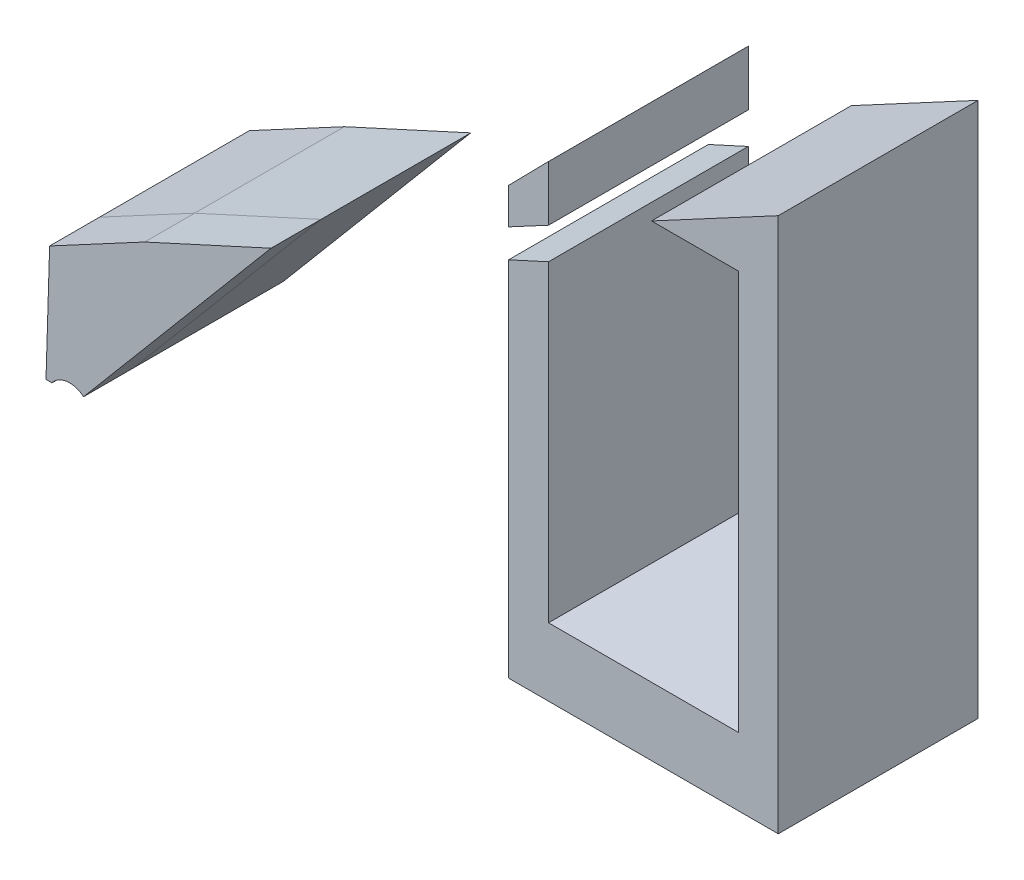
from build123d import *

# Parameters (mm, degrees)
BOSS_EXTRUDE2_DEPTH   = 15
BOSS_EXTRUDE2_2_DEPTH = 15
SKETCH1_3_W           = 4
SKETCH1_3_H           = 40
BOSS_EXTRUDE3_DEPTH   = 20
BOSS_EXTRUDE3_2_DEPTH = 20
BOSS_EXTRUDE4_DEPTH   = 20
BOSS_EXTRUDE5_DEPTH   = 5


with BuildPart() as part:
    # Sketch1 → Boss-Extrude2 (new body)
    with BuildSketch(Plane.XY):
        with BuildLine():
            Line((-90.5, 174.7), (-90.5, 180))
            Line((-90.5, 180), (-109.5, 180))
            Line((-109.5, 180), (-109.5, 174.7))
            ThreePointArc((-109.5, 174.7), (-109.060660172, 173.639339828), (-108, 173.2))
            Line((-108, 173.2), (-106.25, 173.2))
            Line((-106.25, 173.2), (-106.25, 173.789613301))
            ThreePointArc((-106.25, 173.789613301), (-105, 177.8), (-103.75, 173.789613301))
            Line((-103.75, 173.789613301), (-103.75, 173.2))
            Line((-103.75, 173.2), (-96.25, 173.2))
            Line((-96.25, 173.2), (-96.25, 173.789613301))
            ThreePointArc((-96.25, 173.789613301), (-95, 177.8), (-93.75, 173.789613301))
            Line((-93.75, 173.789613301), (-93.75, 173.2))
            Line((-93.75, 173.2), (-92, 173.2))
            ThreePointArc((-92, 173.2), (-90.939339828, 173.639339828), (-90.5, 174.7))
        make_face()
    extrude(amount=BOSS_EXTRUDE2_DEPTH)



with BuildPart() as body_2:
    # Sketch1 → Boss-Extrude2 2 (new body)
    with BuildSketch(Plane.XY):
        with BuildLine():
            Line((-156.05225023, 176.325380111), (-137.282205372, 198.590028265))
            Line((-137.282205372, 198.590028265), (-149.934908507, 192.799492861))
            Line((-149.934908507, 192.799492861), (-159.451892195, 187.698480193))
            Line((-159.451892195, 187.698480193), (-159.505987475, 185.949316479))
            Line((-159.505987475, 185.949316479), (-158.916655937, 185.931090595))
            ThreePointArc((-158.916655937, 185.931090595), (-154.946825197, 184.557720517), (-158.993934909, 183.432285288))
            Line((-158.993934909, 183.432285288), (-159.583266447, 183.450511172))
            Line((-159.583266447, 183.450511172), (-159.815103362, 175.954095252))
            Line((-159.815103362, 175.954095252), (-159.225771824, 175.935869368))
            ThreePointArc((-159.225771824, 175.935869368), (-157.722901503, 176.814118695), (-156.05225023, 176.325380111))
        make_face()
    extrude(amount=BOSS_EXTRUDE2_2_DEPTH)


with BuildPart() as body_3:
    # Sketch1<3> → Boss-Extrude3 (new body)
    with BuildSketch(Plane.XY):
        with Locations((-88.5, 200)):
            Rectangle(SKETCH1_3_W, SKETCH1_3_H)
    extrude(amount=BOSS_EXTRUDE3_DEPTH)


with BuildPart() as body_4:
    # Sketch1<3> → Boss-Extrude3 2 (new body)
    with BuildSketch(Plane.XY):
        Polygon((-109.5, 180), (-109.5, 211.304611235), (-113.5, 209.474003075), (-113.5, 180), align=None)
    extrude(amount=BOSS_EXTRUDE3_2_DEPTH)


with BuildPart() as part_1:
    add(part.part)

    add(body_3.part)  # Boss-Extrude4 merges body 3

    add(body_4.part)  # Boss-Extrude4 merges body 4
    # Sketch1<4> → Boss-Extrude4 (add)
    with BuildSketch(Plane.XY):
        Polygon((-99.186792467, 220), (-86.5, 220), (-86.5, 226.8), align=None)
        with BuildLine():
            Line((-86.5, 180), (-90.5, 180))
            Line((-90.5, 180), (-90.5, 174.7))
            ThreePointArc((-90.5, 174.7), (-90.939339828, 173.639339828), (-92, 173.2))
            Line((-92, 173.2), (-86.5, 173.2))
            Line((-86.5, 173.2), (-86.5, 180))
        make_face()
        with BuildLine():
            Line((-109.5, 174.7), (-109.5, 180))
            Line((-109.5, 180), (-113.5, 180))
            Line((-113.5, 180), (-113.5, 173.2))
            Line((-113.5, 173.2), (-108, 173.2))
            ThreePointArc((-108, 173.2), (-109.060660172, 173.639339828), (-109.5, 174.7))
        make_face()
        Polygon((-113.5, 212.328257006), (-109.5, 214.472218931), (-109.5, 220), (-113.5, 215.93093276), align=None)
    extrude(amount=BOSS_EXTRUDE4_DEPTH)

    # Sketch2 → Boss-Extrude5 (add)
    with BuildSketch(Plane.XY.offset(15)):
        with BuildLine():
            Line((-159.815103362, 175.954095252), (-159.225771824, 175.935869368))
            ThreePointArc((-159.225771824, 175.935869368), (-157.722901503, 176.814118695), (-156.05225023, 176.325380111))
            Line((-156.05225023, 176.325380111), (-137.282205372, 198.590028265))
            Line((-137.282205372, 198.590028265), (-149.934908507, 192.799492861))
            Line((-149.934908507, 192.799492861), (-159.451892195, 187.698480193))
            Line((-159.451892195, 187.698480193), (-159.815103362, 175.954095252))
        make_face()
        with BuildLine():
            ThreePointArc((-92, 173.2), (-90.939339828, 173.639339828), (-90.5, 174.7))
            Line((-90.5, 174.7), (-90.5, 180))
            Line((-90.5, 180), (-109.5, 180))
            Line((-109.5, 180), (-109.5, 174.7))
            ThreePointArc((-109.5, 174.7), (-109.060660172, 173.639339828), (-108, 173.2))
            Line((-108, 173.2), (-92, 173.2))
        make_face()
    extrude(amount=BOSS_EXTRUDE5_DEPTH)


solid = Compound([body_2.part, part_1.part])
